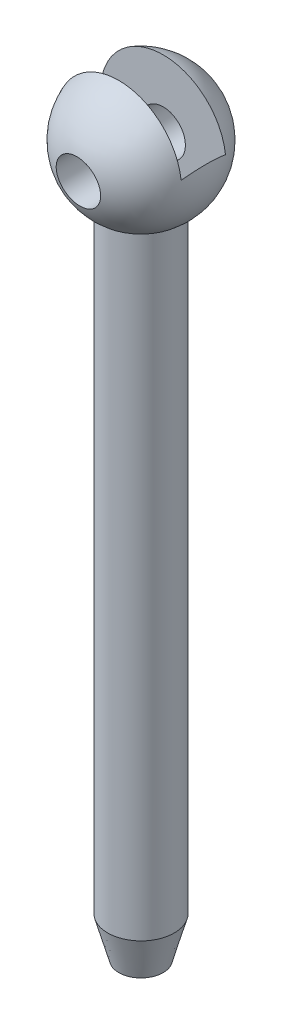
from build123d import *

# Parameters (mm, degrees)
SKETCH2_R          = 5
CUT_EXTRUDE1_DEPTH = 20
CUT_EXTRUDE2_DEPTH = 5


with BuildPart() as part:
    # Sketch1 → Base-Revolve (revolve)
    with BuildSketch(Plane.XY, mode=Mode.PRIVATE) as base_revolve_sk:
        with BuildLine():
            Line((0, -89), (5, -89))
            Line((5, -89), (7.5, -80))
            Line((7.5, -80), (7.5, 58.009618943))
            ThreePointArc((7.5, 58.009618943), (14.488887394, 74.882285677), (0, 86))
            Line((0, 86), (0, -89))
        make_face()
    revolve(base_revolve_sk.sketch.rotate(Axis((0, 111, 0), (0, -1, 0)), 180), axis=Axis((0, 111, 0), (0, -1, 0)))

    # Sketch2 → Cut-Extrude1 (cut, symmetric)
    with BuildSketch(Plane.XY):
        with Locations(Location((0, 70, 0), (0, 0, 236.639256329))):
            Circle(SKETCH2_R)
    extrude(amount=CUT_EXTRUDE1_DEPTH, both=True, mode=Mode.SUBTRACT)

    # Sketch3 → Cut-Extrude2 (cut, symmetric)
    with BuildSketch(Plane.XY):
        with BuildLine():
            Line((40, 110), (-40, 110))
            Line((-40, 110), (-8.209705454, 64.290294546))
            ThreePointArc((-8.209705454, 64.290294546), (0, 60), (8.209705454, 64.290294546))
            Line((8.209705454, 64.290294546), (40, 110))
        make_face()
    extrude(amount=CUT_EXTRUDE2_DEPTH, both=True, mode=Mode.SUBTRACT)


solid = part.part
